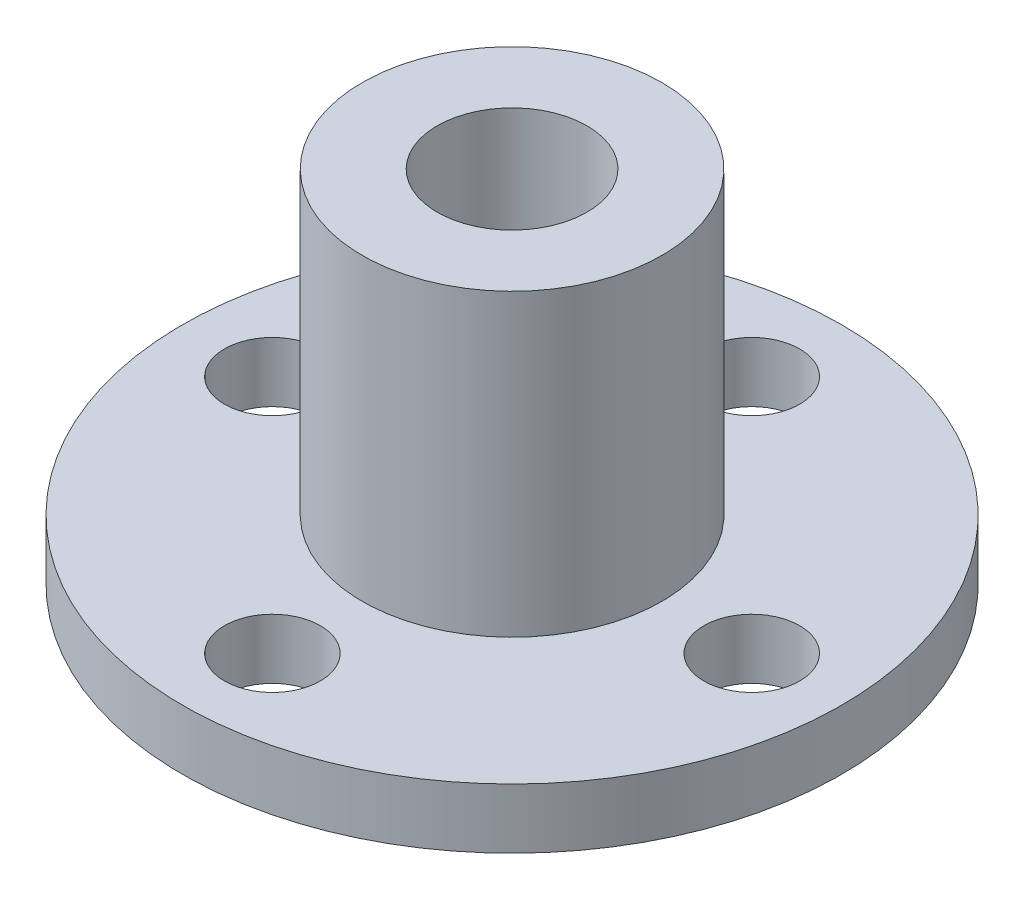
from build123d import *

# Parameters (mm, degrees)
SCHIZZO3_R               = 1.6
TAGLIO_ESTRUSIONE1_DEPTH = 10


with BuildPart() as part:
    # Schizzo2 → Rivoluzione1 (revolve)
    with BuildSketch(Plane.XY, mode=Mode.PRIVATE) as rivoluzione1_sk:
        Polygon((-11, 0), (-2.5, 0), (-2.5, 12), (-5, 12), (-5, 2), (-11, 2), align=None)
    revolve(rivoluzione1_sk.sketch.rotate(Axis((0, 0, 0), (0, 1, 0)), 270), axis=Axis((0, 0, 0), (0, 1, 0)))

    # Schizzo3 → Taglio-Estrusione1 (cut)
    with BuildSketch(Plane(origin=(0, 2, 0), x_dir=(1, 0, 0), z_dir=(0, 1, 0))):
        with Locations(Location((-8, 0, 0), (0, 0, 270))):
            Circle(SCHIZZO3_R)
        with Locations(Location((0, 8, 0), (0, 0, 270))):
            Circle(SCHIZZO3_R)
        with Locations(Location((8, 0, 0), (0, 0, 270))):
            Circle(SCHIZZO3_R)
        with Locations(Location((0, -8, 0), (0, 0, 270))):
            Circle(SCHIZZO3_R)
    extrude(amount=-TAGLIO_ESTRUSIONE1_DEPTH, mode=Mode.SUBTRACT)


solid = part.part
